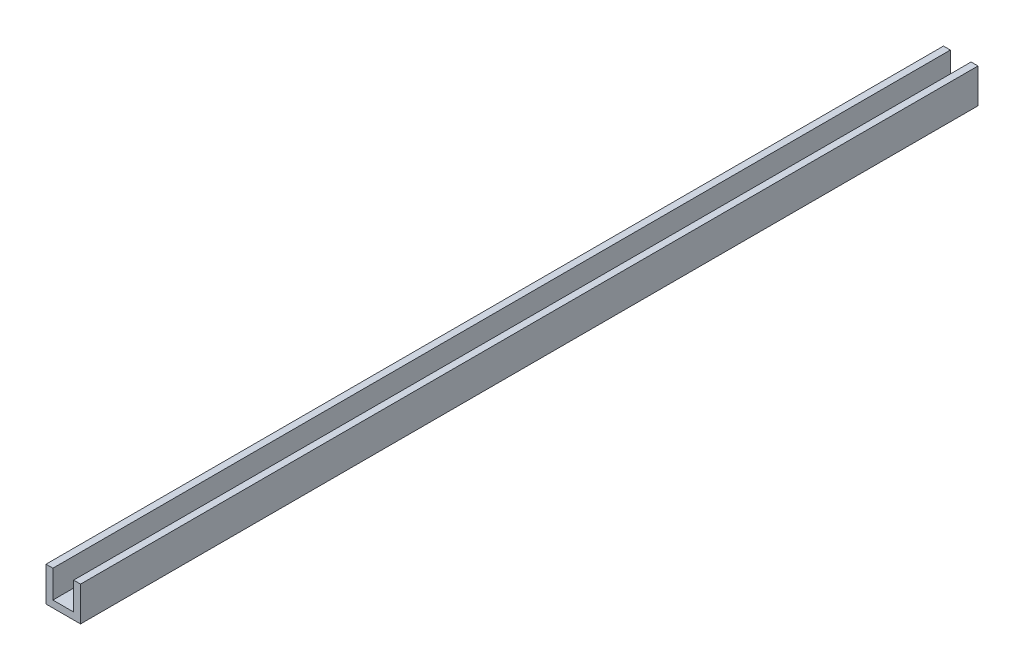
from build123d import *

# Parameters (mm, degrees)
BOSS_EXTRU_1_DEPTH      = 260
ESQUISSE2_R             = 1.25
ENL_V_MAT_EXTRU_1_DEPTH = 10
ESQUISSE3_R             = 1.25
ENL_V_MAT_EXTRU_2_DEPTH = 10


with BuildPart() as part:
    # Esquisse1 → Boss.-Extru.1 (new body)
    with BuildSketch(Plane.XY):
        Polygon((0, 0), (0, -10), (10, -10), (10, 0), (8, 0), (8, -8), (2, -8), (2, 0), align=None)
    extrude(amount=BOSS_EXTRU_1_DEPTH)

    # Esquisse2 → Enlèv. mat.-Extru.1 (cut)
    with BuildSketch(Plane.XZ.offset(10)):
        with Locations(Location((5, 214.21, 0), (0, 0, 270))):
            Circle(ESQUISSE2_R)
    extrude(amount=-ENL_V_MAT_EXTRU_1_DEPTH, mode=Mode.SUBTRACT)

    # Esquisse3 → Enlèv. mat.-Extru.2 (cut)
    with BuildSketch(Plane(origin=(0, -10, 0), x_dir=(-1, 0, 0), z_dir=(0, -1, 0))):
        with Locations(Location((-5, -5, 0), (0, 0, 90))):
            Circle(ESQUISSE3_R)
        with Locations(Location((-5, -55, 0), (0, 0, 90))):
            Circle(ESQUISSE3_R)
    extrude(amount=-ENL_V_MAT_EXTRU_2_DEPTH, mode=Mode.SUBTRACT)


solid = part.part
